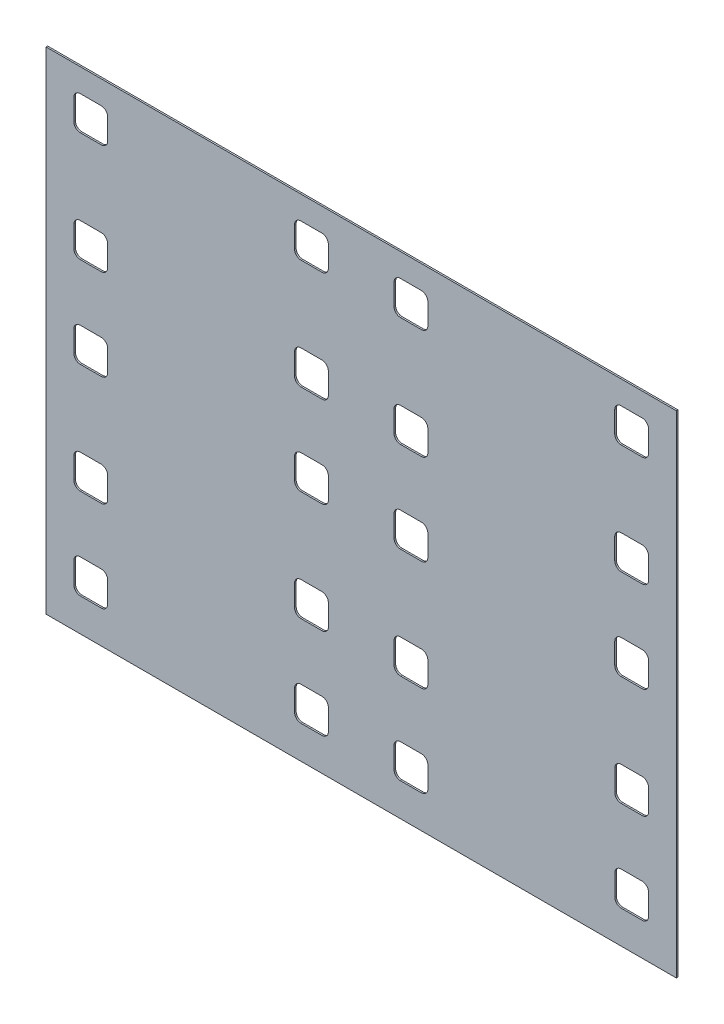
from build123d import *

# Parameters (mm, degrees)
BOSS_EXTRUDE2_DEPTH  = 1.5875
CUT_EXTRUDE6_DEPTH   = 570.657128967
LPATTERN2_COUNT      = 2
LPATTERN2_PITCH      = 217.5764
MIRROR1_COPY_1_DEPTH = 570.657128967


with BuildPart() as part:
    # Sketch9 → Boss-Extrude2 (new body)
    # profile 1 of 6: a face of its own
    with BuildSketch(Plane.XY):
        Polygon((-144.375457148, 172.737459045), (-144.32459706, -311.513538284), (476.933999514, -311.448288512), (476.883139425, 172.802708817), align=None)
        with BuildLine():
            ThreePointArc((-83.637642517, -252.045864104), (-85.497986037, -247.555931408), (-89.988309412, -245.69653107))
            Line((-89.988309412, -245.69653107), (-110.638309298, -245.698699905))
            ThreePointArc((-110.638309298, -245.698699905), (-115.128241995, -247.559043425), (-116.987642333, -252.0493668))
            Line((-116.987642333, -252.0493668), (-116.985473498, -272.699366686))
            ThreePointArc((-116.985473498, -272.699366686), (-115.125129978, -277.189299383), (-110.634806603, -279.048699721))
            Line((-110.634806603, -279.048699721), (-89.984806716, -279.046530886))
            ThreePointArc((-89.984806716, -279.046530886), (-85.49487402, -277.186187366), (-83.635473682, -272.695863991))
            Line((-83.635473682, -272.695863991), (-83.637642517, -252.045864104))
        make_face(mode=Mode.SUBTRACT)
        with BuildLine():
            ThreePointArc((-110.66846521, 41.42289851), (-115.158397906, 39.56255499), (-117.017798245, 35.072231615))
            Line((-117.017798245, 35.072231615), (-117.015629409, 14.422231729))
            ThreePointArc((-117.015629409, 14.422231729), (-115.155285889, 9.932299033), (-110.664962514, 8.072898694))
            Line((-110.664962514, 8.072898694), (-90.014962628, 8.07506753))
            ThreePointArc((-90.014962628, 8.07506753), (-85.525029931, 9.93541105), (-83.665629593, 14.425734425))
            Line((-83.665629593, 14.425734425), (-83.667798429, 35.075734311))
            ThreePointArc((-83.667798429, 35.075734311), (-85.528141949, 39.565667008), (-90.018465324, 41.425067346))
            Line((-90.018465324, 41.425067346), (-110.66846521, 41.42289851))
        make_face(mode=Mode.SUBTRACT)
        with BuildLine():
            ThreePointArc((-117.027004568, 122.727831133), (-115.166661048, 118.237898436), (-110.676337673, 116.378498098))
            Line((-110.676337673, 116.378498098), (-90.026337787, 116.380666933))
            ThreePointArc((-90.026337787, 116.380666933), (-85.53640509, 118.241010453), (-83.677004752, 122.731333828))
            Line((-83.677004752, 122.731333828), (-83.679173588, 143.381333715))
            ThreePointArc((-83.679173588, 143.381333715), (-85.539517108, 147.871266411), (-90.029840483, 149.730666749))
            Line((-90.029840483, 149.730666749), (-110.679840369, 149.728497914))
            ThreePointArc((-110.679840369, 149.728497914), (-115.169773065, 147.868154394), (-117.029173404, 143.377831019))
            Line((-117.029173404, 143.377831019), (-117.027004568, 122.727831133))
        make_face(mode=Mode.SUBTRACT)
        with BuildLine():
            ThreePointArc((-117.006239033, -74.985767777), (-115.145895513, -79.475700473), (-110.655572138, -81.335100812))
            Line((-110.655572138, -81.335100812), (-90.005572252, -81.332931976))
            ThreePointArc((-90.005572252, -81.332931976), (-85.515639555, -79.472588456), (-83.656239217, -74.982265081))
            Line((-83.656239217, -74.982265081), (-83.658408052, -54.332265195))
            ThreePointArc((-83.658408052, -54.332265195), (-85.518751572, -49.842332499), (-90.009074947, -47.98293216))
            Line((-90.009074947, -47.98293216), (-110.659074834, -47.985100996))
            ThreePointArc((-110.659074834, -47.985100996), (-115.14900753, -49.845444516), (-117.008407868, -54.335767891))
            Line((-117.008407868, -54.335767891), (-117.006239033, -74.985767777))
        make_face(mode=Mode.SUBTRACT)
        with BuildLine():
            ThreePointArc((-116.994863874, -183.29136718), (-115.134520354, -187.781299877), (-110.644196979, -189.640700215))
            Line((-110.644196979, -189.640700215), (-89.994197093, -189.63853138))
            ThreePointArc((-89.994197093, -189.63853138), (-85.504264396, -187.77818786), (-83.644864058, -183.287864484))
            Line((-83.644864058, -183.287864484), (-83.647032894, -162.637864598))
            ThreePointArc((-83.647032894, -162.637864598), (-85.507376414, -158.147931902), (-89.997699789, -156.288531563))
            Line((-89.997699789, -156.288531563), (-110.647699675, -156.290700399))
            ThreePointArc((-110.647699675, -156.290700399), (-115.137632371, -158.151043919), (-116.99703271, -162.641367294))
            Line((-116.99703271, -162.641367294), (-116.994863874, -183.29136718))
        make_face(mode=Mode.SUBTRACT)
    # profile 2 of 6: a face of its own
    with BuildSketch(Plane.XY):
        with BuildLine():
            Line((-83.635473682, -272.695863991), (-83.637642517, -252.045864104))
            ThreePointArc((-83.637642517, -252.045864104), (-85.497986037, -247.555931408), (-89.988309412, -245.69653107))
            Line((-89.988309412, -245.69653107), (-110.638309298, -245.698699905))
            ThreePointArc((-110.638309298, -245.698699905), (-115.128241995, -247.559043425), (-116.987642333, -252.0493668))
            Line((-116.987642333, -252.0493668), (-116.985473498, -272.699366686))
            ThreePointArc((-116.985473498, -272.699366686), (-115.125129978, -277.189299383), (-110.634806603, -279.048699721))
            Line((-110.634806603, -279.048699721), (-89.984806716, -279.046530886))
            ThreePointArc((-89.984806716, -279.046530886), (-85.49487402, -277.186187366), (-83.635473682, -272.695863991))
        make_face()
    # profile 3 of 6: a face of its own
    with BuildSketch(Plane.XY):
        with BuildLine():
            Line((-116.99703271, -162.641367294), (-116.994863874, -183.29136718))
            ThreePointArc((-116.994863874, -183.29136718), (-115.134520354, -187.781299877), (-110.644196979, -189.640700215))
            Line((-110.644196979, -189.640700215), (-89.994197093, -189.63853138))
            ThreePointArc((-89.994197093, -189.63853138), (-85.504264396, -187.77818786), (-83.644864058, -183.287864484))
            Line((-83.644864058, -183.287864484), (-83.647032894, -162.637864598))
            ThreePointArc((-83.647032894, -162.637864598), (-85.507376414, -158.147931902), (-89.997699789, -156.288531563))
            Line((-89.997699789, -156.288531563), (-110.647699675, -156.290700399))
            ThreePointArc((-110.647699675, -156.290700399), (-115.137632371, -158.151043919), (-116.99703271, -162.641367294))
        make_face()
    # profile 4 of 6: a face of its own
    with BuildSketch(Plane.XY):
        with BuildLine():
            Line((-90.018465324, 41.425067346), (-110.66846521, 41.42289851))
            ThreePointArc((-110.66846521, 41.42289851), (-115.158397906, 39.56255499), (-117.017798245, 35.072231615))
            Line((-117.017798245, 35.072231615), (-117.015629409, 14.422231729))
            ThreePointArc((-117.015629409, 14.422231729), (-115.155285889, 9.932299033), (-110.664962514, 8.072898694))
            Line((-110.664962514, 8.072898694), (-90.014962628, 8.07506753))
            ThreePointArc((-90.014962628, 8.07506753), (-85.525029931, 9.93541105), (-83.665629593, 14.425734425))
            Line((-83.665629593, 14.425734425), (-83.667798429, 35.075734311))
            ThreePointArc((-83.667798429, 35.075734311), (-85.528141949, 39.565667008), (-90.018465324, 41.425067346))
        make_face()
    # profile 5 of 6: a face of its own
    with BuildSketch(Plane.XY):
        with BuildLine():
            Line((-117.029173404, 143.377831019), (-117.027004568, 122.727831133))
            ThreePointArc((-117.027004568, 122.727831133), (-115.166661048, 118.237898436), (-110.676337673, 116.378498098))
            Line((-110.676337673, 116.378498098), (-90.026337787, 116.380666933))
            ThreePointArc((-90.026337787, 116.380666933), (-85.53640509, 118.241010453), (-83.677004752, 122.731333828))
            Line((-83.677004752, 122.731333828), (-83.679173588, 143.381333715))
            ThreePointArc((-83.679173588, 143.381333715), (-85.539517108, 147.871266411), (-90.029840483, 149.730666749))
            Line((-90.029840483, 149.730666749), (-110.679840369, 149.728497914))
            ThreePointArc((-110.679840369, 149.728497914), (-115.169773065, 147.868154394), (-117.029173404, 143.377831019))
        make_face()
    # profile 6 of 6: a face of its own
    with BuildSketch(Plane.XY):
        with BuildLine():
            Line((-117.008407868, -54.335767891), (-117.006239033, -74.985767777))
            ThreePointArc((-117.006239033, -74.985767777), (-115.145895513, -79.475700473), (-110.655572138, -81.335100812))
            Line((-110.655572138, -81.335100812), (-90.005572252, -81.332931976))
            ThreePointArc((-90.005572252, -81.332931976), (-85.515639555, -79.472588456), (-83.656239217, -74.982265081))
            Line((-83.656239217, -74.982265081), (-83.658408052, -54.332265195))
            ThreePointArc((-83.658408052, -54.332265195), (-85.518751572, -49.842332499), (-90.009074947, -47.98293216))
            Line((-90.009074947, -47.98293216), (-110.659074834, -47.985100996))
            ThreePointArc((-110.659074834, -47.985100996), (-115.14900753, -49.845444516), (-117.008407868, -54.335767891))
        make_face()
    extrude(amount=BOSS_EXTRUDE2_DEPTH)

    # Sketch10 → Cut-Extrude6 (cut, through all)
    with BuildSketch(Plane.XY.offset(1.5875)):
        with BuildLine():
            Line((-83.677004752, 122.731333828), (-83.679173588, 143.381333715))
            ThreePointArc((-83.679173588, 143.381333715), (-85.539517108, 147.871266411), (-90.029840483, 149.730666749))
            Line((-90.029840483, 149.730666749), (-110.679840369, 149.728497914))
            ThreePointArc((-110.679840369, 149.728497914), (-115.169773065, 147.868154394), (-117.029173404, 143.377831019))
            Line((-117.029173404, 143.377831019), (-117.027004568, 122.727831133))
            ThreePointArc((-117.027004568, 122.727831133), (-115.166661048, 118.237898436), (-110.676337673, 116.378498098))
            Line((-110.676337673, 116.378498098), (-90.026337787, 116.380666933))
            ThreePointArc((-90.026337787, 116.380666933), (-85.53640509, 118.241010453), (-83.677004752, 122.731333828))
        make_face()
        with BuildLine():
            Line((-117.017798245, 35.072231615), (-117.015629409, 14.422231729))
            ThreePointArc((-117.015629409, 14.422231729), (-115.155285889, 9.932299033), (-110.664962514, 8.072898694))
            Line((-110.664962514, 8.072898694), (-90.014962628, 8.07506753))
            ThreePointArc((-90.014962628, 8.07506753), (-85.525029931, 9.93541105), (-83.665629593, 14.425734425))
            Line((-83.665629593, 14.425734425), (-83.667798429, 35.075734311))
            ThreePointArc((-83.667798429, 35.075734311), (-85.528141949, 39.565667008), (-90.018465324, 41.425067346))
            Line((-90.018465324, 41.425067346), (-110.66846521, 41.42289851))
            ThreePointArc((-110.66846521, 41.42289851), (-115.158397906, 39.56255499), (-117.017798245, 35.072231615))
        make_face()
        with BuildLine():
            Line((-83.656239217, -74.982265081), (-83.658408052, -54.332265195))
            ThreePointArc((-83.658408052, -54.332265195), (-85.518751572, -49.842332499), (-90.009074947, -47.98293216))
            Line((-90.009074947, -47.98293216), (-110.659074834, -47.985100996))
            ThreePointArc((-110.659074834, -47.985100996), (-115.14900753, -49.845444516), (-117.008407868, -54.335767891))
            Line((-117.008407868, -54.335767891), (-117.006239033, -74.985767777))
            ThreePointArc((-117.006239033, -74.985767777), (-115.145895513, -79.475700473), (-110.655572138, -81.335100812))
            Line((-110.655572138, -81.335100812), (-90.005572252, -81.332931976))
            ThreePointArc((-90.005572252, -81.332931976), (-85.515639555, -79.472588456), (-83.656239217, -74.982265081))
        make_face()
        with BuildLine():
            Line((-89.997699789, -156.288531563), (-110.647699675, -156.290700399))
            ThreePointArc((-110.647699675, -156.290700399), (-115.137632371, -158.151043919), (-116.99703271, -162.641367294))
            Line((-116.99703271, -162.641367294), (-116.994863874, -183.29136718))
            ThreePointArc((-116.994863874, -183.29136718), (-115.134520354, -187.781299877), (-110.644196979, -189.640700215))
            Line((-110.644196979, -189.640700215), (-89.994197093, -189.63853138))
            ThreePointArc((-89.994197093, -189.63853138), (-85.504264396, -187.77818786), (-83.644864058, -183.287864484))
            Line((-83.644864058, -183.287864484), (-83.647032894, -162.637864598))
            ThreePointArc((-83.647032894, -162.637864598), (-85.507376414, -158.147931902), (-89.997699789, -156.288531563))
        make_face()
        with BuildLine():
            Line((-116.987642333, -252.0493668), (-116.985473498, -272.699366686))
            ThreePointArc((-116.985473498, -272.699366686), (-115.125129978, -277.189299383), (-110.634806603, -279.048699721))
            Line((-110.634806603, -279.048699721), (-89.984806716, -279.046530886))
            ThreePointArc((-89.984806716, -279.046530886), (-85.49487402, -277.186187366), (-83.635473682, -272.695863991))
            Line((-83.635473682, -272.695863991), (-83.637642517, -252.045864104))
            ThreePointArc((-83.637642517, -252.045864104), (-85.497986037, -247.555931408), (-89.988309412, -245.69653107))
            Line((-89.988309412, -245.69653107), (-110.638309298, -245.698699905))
            ThreePointArc((-110.638309298, -245.698699905), (-115.128241995, -247.559043425), (-116.987642333, -252.0493668))
        make_face()
    cut_extrude6 = extrude(amount=-CUT_EXTRUDE6_DEPTH, mode=Mode.SUBTRACT)

    # LPattern2: Cut-Extrude6 ×2
    with Locations(*[Vector(0.9999999944845218, 0.00010502836011308978, 0) * (i * LPATTERN2_PITCH) for i in range(1, LPATTERN2_COUNT)]):
        add(cut_extrude6, mode=Mode.SUBTRACT)

    # Mirror1: Cut-Extrude6 across plane
    add(cut_extrude6.mirror(Plane(origin=(166.271985063, 0.017463274, 0), x_dir=(0, 0, 1), z_dir=(-0.9999999944845219, -0.00010502836011320445, 0))), mode=Mode.SUBTRACT)

    # Mirror1 copy 1 sketch → Mirror1 copy 1 (cut, through all)
    with BuildSketch(Plane(origin=(114.967571326, 0.012074856, 1.5875), x_dir=(-0.9999999779380877, -0.00021005671906784565, 0), z_dir=(0, 0, 1))):
        with BuildLine():
            Line((-83.677004752, -122.731333828), (-83.679173588, -143.381333715))
            ThreePointArc((-83.679173588, -143.381333715), (-85.539517108, -147.871266411), (-90.029840483, -149.730666749))
            Line((-90.029840483, -149.730666749), (-110.679840369, -149.728497914))
            ThreePointArc((-110.679840369, -149.728497914), (-115.169773065, -147.868154394), (-117.029173404, -143.377831019))
            Line((-117.029173404, -143.377831019), (-117.027004568, -122.727831133))
            ThreePointArc((-117.027004568, -122.727831133), (-115.166661048, -118.237898436), (-110.676337673, -116.378498098))
            Line((-110.676337673, -116.378498098), (-90.026337787, -116.380666933))
            ThreePointArc((-90.026337787, -116.380666933), (-85.53640509, -118.241010453), (-83.677004752, -122.731333828))
        make_face()
        with BuildLine():
            Line((-117.017798245, -35.072231615), (-117.015629409, -14.422231729))
            ThreePointArc((-117.015629409, -14.422231729), (-115.155285889, -9.932299033), (-110.664962514, -8.072898694))
            Line((-110.664962514, -8.072898694), (-90.014962628, -8.07506753))
            ThreePointArc((-90.014962628, -8.07506753), (-85.525029931, -9.93541105), (-83.665629593, -14.425734425))
            Line((-83.665629593, -14.425734425), (-83.667798429, -35.075734311))
            ThreePointArc((-83.667798429, -35.075734311), (-85.528141949, -39.565667008), (-90.018465324, -41.425067346))
            Line((-90.018465324, -41.425067346), (-110.66846521, -41.42289851))
            ThreePointArc((-110.66846521, -41.42289851), (-115.158397906, -39.56255499), (-117.017798245, -35.072231615))
        make_face()
        with BuildLine():
            Line((-83.656239217, 74.982265081), (-83.658408052, 54.332265195))
            ThreePointArc((-83.658408052, 54.332265195), (-85.518751572, 49.842332499), (-90.009074947, 47.98293216))
            Line((-90.009074947, 47.98293216), (-110.659074834, 47.985100996))
            ThreePointArc((-110.659074834, 47.985100996), (-115.14900753, 49.845444516), (-117.008407868, 54.335767891))
            Line((-117.008407868, 54.335767891), (-117.006239033, 74.985767777))
            ThreePointArc((-117.006239033, 74.985767777), (-115.145895513, 79.475700473), (-110.655572138, 81.335100812))
            Line((-110.655572138, 81.335100812), (-90.005572252, 81.332931976))
            ThreePointArc((-90.005572252, 81.332931976), (-85.515639555, 79.472588456), (-83.656239217, 74.982265081))
        make_face()
        with BuildLine():
            Line((-89.997699789, 156.288531563), (-110.647699675, 156.290700399))
            ThreePointArc((-110.647699675, 156.290700399), (-115.137632371, 158.151043919), (-116.99703271, 162.641367294))
            Line((-116.99703271, 162.641367294), (-116.994863874, 183.29136718))
            ThreePointArc((-116.994863874, 183.29136718), (-115.134520354, 187.781299877), (-110.644196979, 189.640700215))
            Line((-110.644196979, 189.640700215), (-89.994197093, 189.63853138))
            ThreePointArc((-89.994197093, 189.63853138), (-85.504264396, 187.77818786), (-83.644864058, 183.287864484))
            Line((-83.644864058, 183.287864484), (-83.647032894, 162.637864598))
            ThreePointArc((-83.647032894, 162.637864598), (-85.507376414, 158.147931902), (-89.997699789, 156.288531563))
        make_face()
        with BuildLine():
            Line((-116.987642333, 252.0493668), (-116.985473498, 272.699366686))
            ThreePointArc((-116.985473498, 272.699366686), (-115.125129978, 277.189299383), (-110.634806603, 279.048699721))
            Line((-110.634806603, 279.048699721), (-89.984806716, 279.046530886))
            ThreePointArc((-89.984806716, 279.046530886), (-85.49487402, 277.186187366), (-83.635473682, 272.695863991))
            Line((-83.635473682, 272.695863991), (-83.637642517, 252.045864104))
            ThreePointArc((-83.637642517, 252.045864104), (-85.497986037, 247.555931408), (-89.988309412, 245.69653107))
            Line((-89.988309412, 245.69653107), (-110.638309298, 245.698699905))
            ThreePointArc((-110.638309298, 245.698699905), (-115.128241995, 247.559043425), (-116.987642333, 252.0493668))
        make_face()
    extrude(amount=-MIRROR1_COPY_1_DEPTH, mode=Mode.SUBTRACT)


solid = part.part
